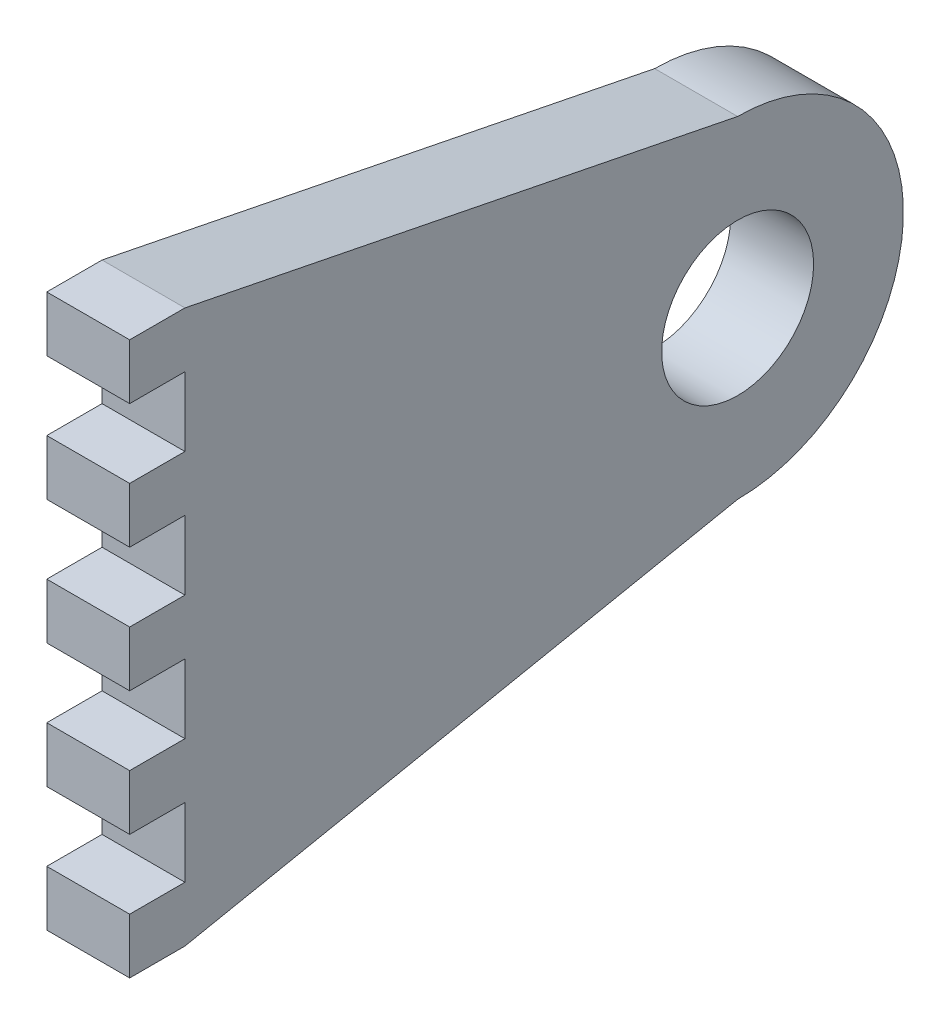
from build123d import *

# Parameters (mm, degrees)
SKETCH1_R           = 2.75
BOSS_EXTRUDE1_DEPTH = 3


with BuildPart() as part:
    # Sketch1 → Boss-Extrude1 (new body)
    with BuildSketch(Plane(origin=(0, 0, 0), x_dir=(0, 0, -1), z_dir=(1, 0, 0))):
        with BuildLine():
            Line((-20, 5.5), (-22, 5.5))
            Line((-22, 5.5), (-22, 3.5))
            Line((-22, 3.5), (-20, 3.5))
            Line((-20, 3.5), (-20, 1))
            Line((-20, 1), (-22, 1))
            Line((-22, 1), (-22, -1))
            Line((-22, -1), (-20, -1))
            Line((-20, -1), (-20, -3.5))
            Line((-20, -3.5), (-22, -3.5))
            Line((-22, -3.5), (-22, -5.5))
            Line((-22, -5.5), (-20, -5.5))
            Line((-20, -5.5), (-20, -8))
            Line((-20, -8), (-22, -8))
            Line((-22, -8), (-22, -10))
            Line((-22, -10), (-20, -10))
            Line((-20, -10), (0, -6))
            ThreePointArc((0, -6), (6, 0), (0, 6))
            Line((0, 6), (-20, 10))
            Line((-20, 10), (-22, 10))
            Line((-22, 10), (-22, 8))
            Line((-22, 8), (-20, 8))
            Line((-20, 8), (-20, 5.5))
        make_face()
        Circle(SKETCH1_R, mode=Mode.SUBTRACT)
    extrude(amount=BOSS_EXTRUDE1_DEPTH)


solid = part.part
